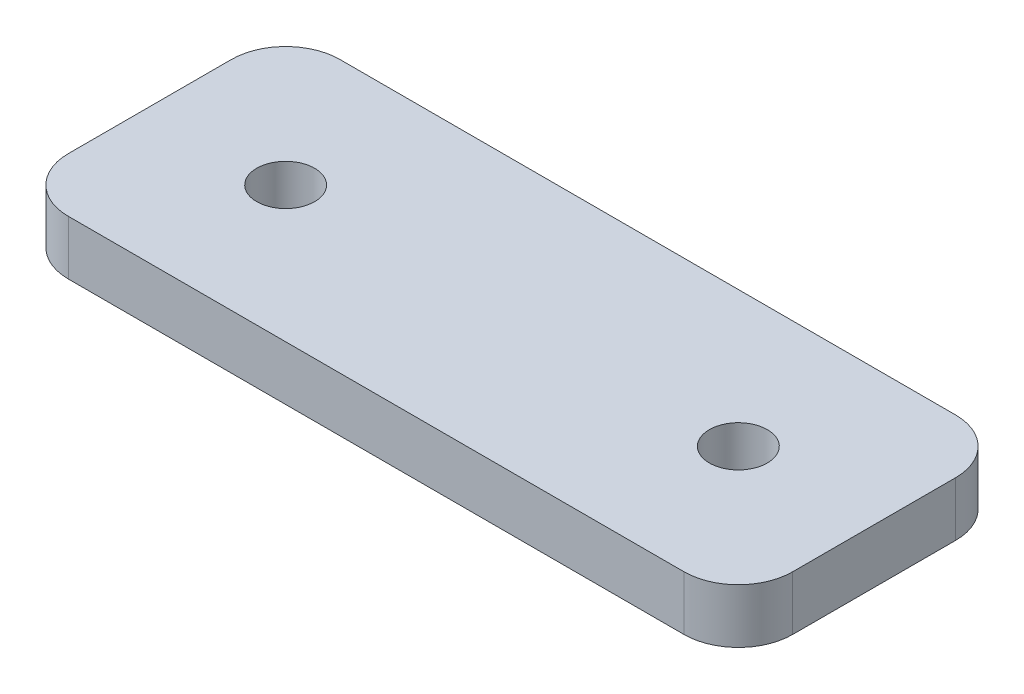
from build123d import *

# Parameters (mm, degrees)
SKETCH_1_W      = 40
SKETCH_1_H      = 15
SKETCH_1_R      = 1.6
EXTRUDE_1_DEPTH = 3
FILLET_1_R      = 3


with BuildPart() as part:
    # 草图1 → 凸台-拉伸1 (new body)
    with BuildSketch(Plane(origin=(0, 0, 0), x_dir=(1, 0, 0), z_dir=(0, 1, 0))):
        Rectangle(SKETCH_1_W, SKETCH_1_H)
        with Locations(Location((-12.5, 0, 0), (0, 0, 270))):
            Circle(SKETCH_1_R, mode=Mode.SUBTRACT)
        with Locations(Location((12.5, 0, 0), (0, 0, 90))):
            Circle(SKETCH_1_R, mode=Mode.SUBTRACT)
    extrude(amount=EXTRUDE_1_DEPTH)

    # 圆角1
    fillet_1_edges = [part.edges().sort_by_distance(p)[0] for p in [
        (20, 1.5, 7.5),
        (-20, 1.5, 7.5),
        (-20, 1.5, -7.5),
        (20, 1.5, -7.5),
    ]]
    fillet(fillet_1_edges, radius=FILLET_1_R)


solid = part.part
